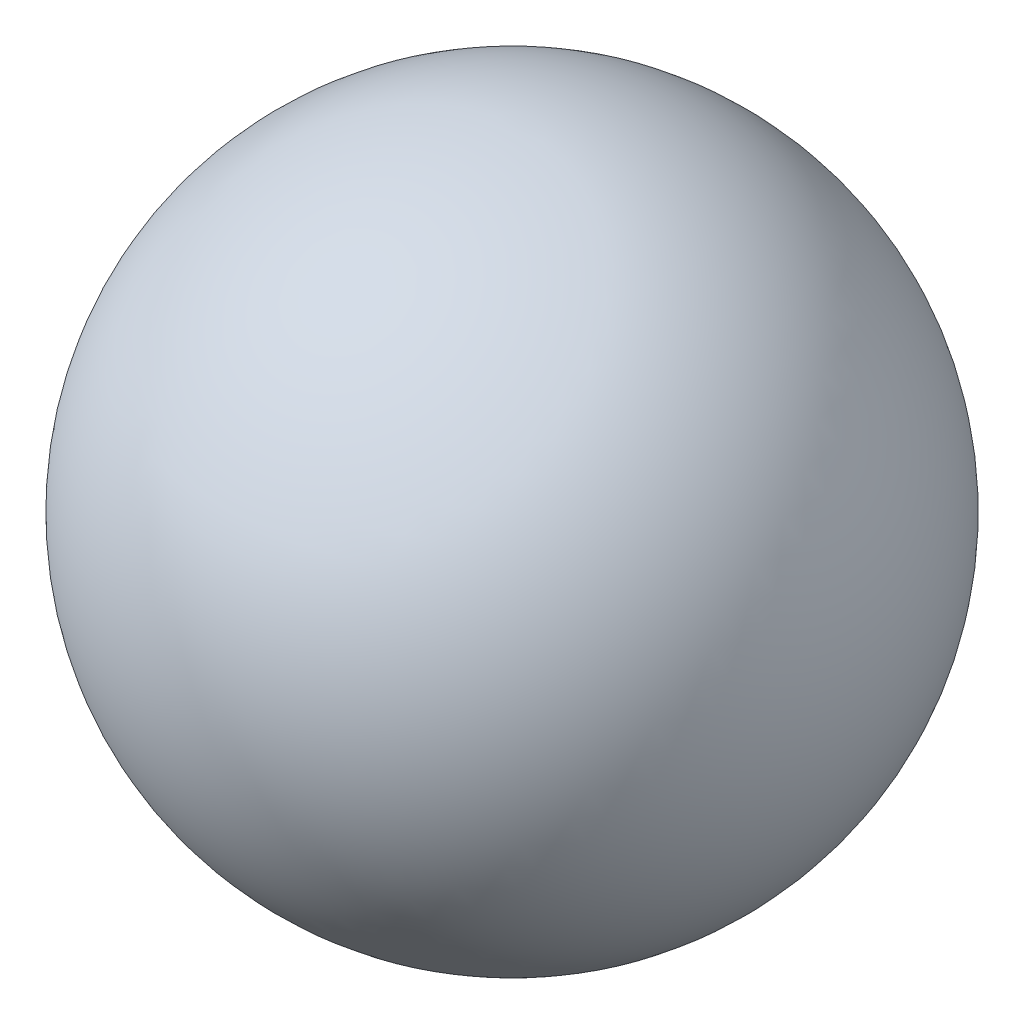
from build123d import *


with BuildPart() as part:
    # Sketch1 → Revolve-Thin1 (revolve)
    with BuildSketch(Plane.XY):
        with BuildLine():
            ThreePointArc((0, 304.8), (304.8, 0), (0, -304.8))
            Line((0, -304.8), (0, -302.26))
            ThreePointArc((0, -302.26), (302.26, 0), (0, 302.26))
            Line((0, 302.26), (0, 304.8))
        make_face()
    revolve(axis=Axis((0, 56.592804598, 0), (0, -1, 0)))


solid = part.part
